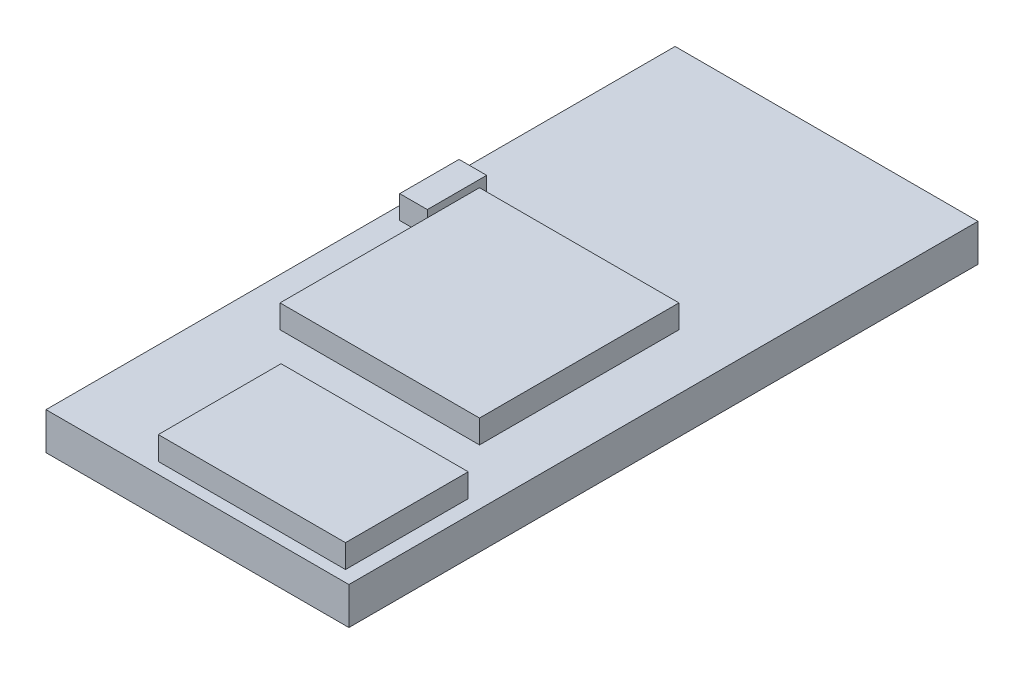
from build123d import *

# Parameters (mm, degrees)
SKETCH_1_W      = 13
SKETCH_1_H      = 27
EXTRUDE_1_DEPTH = 1.6
SKETCH_2_W      = 8.033918408
SKETCH_2_H      = 5.268143219
SKETCH_2_W_2    = 8.560732729
SKETCH_2_H_2    = 8.56073273
SKETCH_2_W_3    = 1.185332224
SKETCH_2_H_3    = 2.546269222
EXTRUDE_2_DEPTH = 1


with BuildPart() as part:
    # 草图1 → 凸台-拉伸1 (new body)
    with BuildSketch(Plane(origin=(0, 0, 0), x_dir=(1, 0, 0), z_dir=(0, 1, 0))):
        Rectangle(SKETCH_1_W, SKETCH_1_H)
    extrude(amount=EXTRUDE_1_DEPTH)

    # 草图2 → 凸台-拉伸2 (add)
    with BuildSketch(Plane(origin=(0, 1.6, 0), x_dir=(1, 0, 0), z_dir=(0, 1, 0))):
        with Locations((1.853625196, -10.38263226)):
            Rectangle(SKETCH_2_W, SKETCH_2_H)
        with Locations((-0.165829704, -1.229233418)):
            Rectangle(SKETCH_2_W_2, SKETCH_2_H_2)
        with Locations((-5.346170536, 2.392615045)):
            Rectangle(SKETCH_2_W_3, SKETCH_2_H_3)
    extrude(amount=EXTRUDE_2_DEPTH)


solid = part.part
